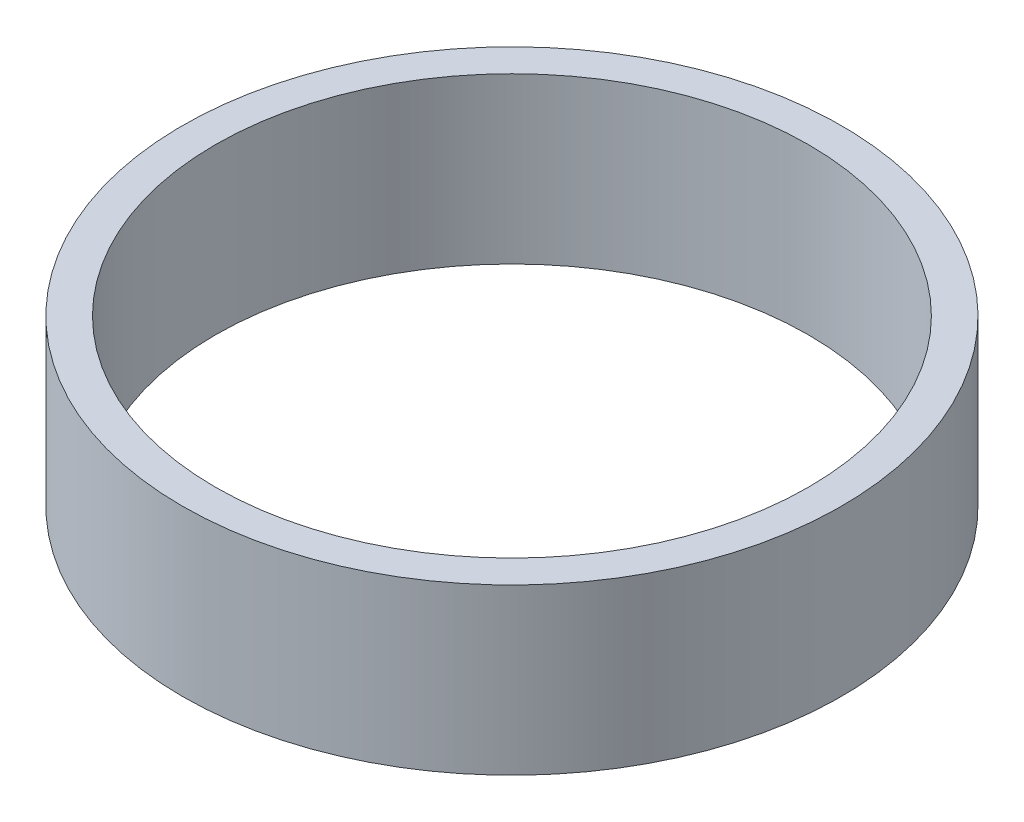
from build123d import *

# Parameters (mm, degrees)
SKETCH1_R           = 40
SKETCH1_R_2         = 36
BOSS_EXTRUDE1_DEPTH = 20


with BuildPart() as part:
    # Sketch1 → Boss-Extrude1 (new body)
    with BuildSketch(Plane(origin=(0, 0, 0), x_dir=(1, 0, 0), z_dir=(0, 1, 0))):
        with Locations(Location((0, 0, 0), (0, 0, 270))):
            Circle(SKETCH1_R)
        with Locations(Location((0, 0, 0), (0, 0, 270))):
            Circle(SKETCH1_R_2, mode=Mode.SUBTRACT)
    extrude(amount=BOSS_EXTRUDE1_DEPTH)


solid = part.part
